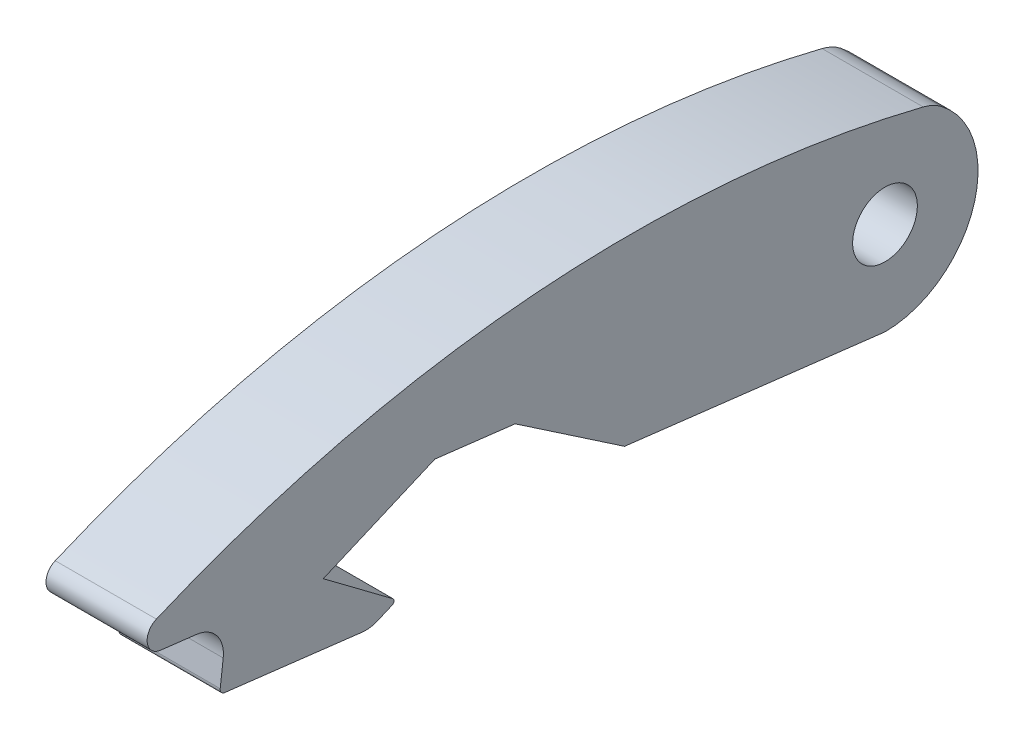
from build123d import *

# Parameters (mm, degrees)
SKETCH2_R           = 1.6
BOSS_EXTRUDE1_DEPTH = 5
FILLET2_R           = 1.5
CHAMFER1_SIZE       = 2.5
CHAMFER1_SIZE2      = 1.443375673
FILLET3_R           = 1.5
FILLET4_R           = 0.25
FILLET5_R           = 0.15
FILLET6_R           = 0.75
FILLET7_R           = 2.5


with BuildPart() as part:
    # Sketch2 → Boss-Extrude1 (new body)
    with BuildSketch(Plane.YZ):
        with BuildLine():
            Line((0, 38.5), (-0.711820293, 32.542373638))
            Line((-0.711820293, 32.542373638), (-3.690633474, 32.898283784))
            Line((-3.690633474, 32.898283784), (-4.877000628, 22.968906514))
            Line((-4.877000628, 22.968906514), (-1.281732991, 27.772452143))
            Line((-1.281732991, 27.772452143), (1.080625734, 22.257086221))
            Line((1.080625734, 22.257086221), (0.606078872, 18.285335313))
            Line((0.606078872, 18.285335313), (-3.061283722, 12.878386238))
            Line((-3.061283722, 12.878386238), (-4.6, 0))
            ThreePointArc((-4.6, 0), (-1.190567607, -4.443258801), (3.983716857, -2.3))
            ThreePointArc((3.983716857, -2.3), (5.584415843, 18.450777734), (0, 38.5))
        make_face()
        with Locations(Location((0, 0, 0), (0, 0, 270))):
            Circle(SKETCH2_R, mode=Mode.SUBTRACT)
    extrude(amount=BOSS_EXTRUDE1_DEPTH)

    # Fillet2
    fillet2_edges = [part.edges().sort_by_distance(p)[0] for p in [
        (2.5, -0.711820293, 32.542373638),
    ]]
    fillet(fillet2_edges, radius=FILLET2_R)

    # Chamfer1
    chamfer1_edges = [part.edges().sort_by_distance(p)[0] for p in [
        (2.5, -4.877000628, 22.968906514),
    ]]
    chamfer1_side = [part.faces().sort_by_distance(p)[0] for p in [
        (2.5, -4.283817051, 27.933595149),
    ]]
    chamfer(chamfer1_edges, length=CHAMFER1_SIZE, length2=CHAMFER1_SIZE2, reference=chamfer1_side[0])

    # Fillet3
    fillet3_edges = [part.edges().sort_by_distance(p)[0] for p in [
        (2.5, -4.580408839, 25.451250831),
    ]]
    fillet(fillet3_edges, radius=FILLET3_R)

    # Fillet4
    fillet4_edges = [part.edges().sort_by_distance(p)[0] for p in [
        (2.5, -3.690633474, 32.898283784),
    ]]
    fillet(fillet4_edges, radius=FILLET4_R)

    # Fillet5
    fillet5_edges = [part.edges().sort_by_distance(p)[0] for p in [
        (2.5, -4.012113654, 24.124459998),
    ]]
    fillet(fillet5_edges, radius=FILLET5_R)

    # Fillet6
    fillet6_edges = [part.edges().sort_by_distance(p)[0] for p in [
        (2.5, 0, 38.5),
    ]]
    fillet(fillet6_edges, radius=FILLET6_R)

    # Fillet7
    fillet7_edges = [part.edges().sort_by_distance(p)[0] for p in [
        (2.5, 3.983716857, -2.3),
    ]]
    fillet(fillet7_edges, radius=FILLET7_R)


solid = part.part
